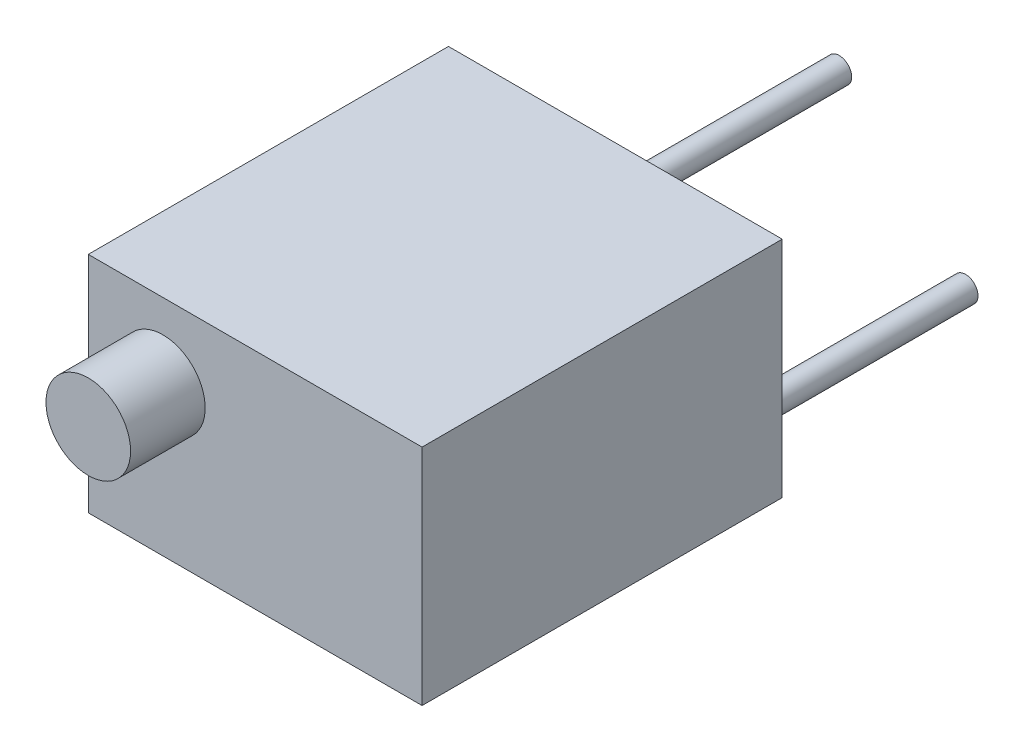
from build123d import *

# Parameters (mm, degrees)
EXTRUDE_1_DEPTH      = 2.25
EXTRUDE_1_DEPTH_BACK = 2.25
SKETCH_1_W           = 6.71
SKETCH_1_H           = 7.24
SKETCH_3_R           = 0.25
EXTRUDE_3_DEPTH      = 4.5
SKETCH_4_R           = 0.85
EXTRUDE_4_DEPTH      = 1.5


with BuildPart() as part:
    # 草图1 → 拉伸1 (new, two sides: drawn at the far end of the back side and taken through both)
    with BuildSketch(Plane(origin=(0, 0, 0), x_dir=(1, 0, 0), z_dir=(0, 1, 0)).offset(-EXTRUDE_1_DEPTH_BACK)):
        Rectangle(SKETCH_1_W, SKETCH_1_H)
    extrude(amount=EXTRUDE_1_DEPTH + EXTRUDE_1_DEPTH_BACK)

    # 草图3 → 拉伸3 (add)
    with BuildSketch(Plane(origin=(0, 0, -3.62), x_dir=(-1, 0, 0), z_dir=(0, 0, -1))):
        with Locations((0, 1.27)):
            Circle(SKETCH_3_R)
        with Locations((2.54, -1.27)):
            Circle(SKETCH_3_R)
        with Locations((-2.54, -1.27)):
            Circle(SKETCH_3_R)
    extrude(amount=EXTRUDE_3_DEPTH)

    # 草图4 → 拉伸4 (add)
    with BuildSketch(Plane.XY.offset(3.62)):
        with Locations((-1.855, 0.75)):
            Circle(SKETCH_4_R)
    extrude(amount=EXTRUDE_4_DEPTH)


solid = part.part
